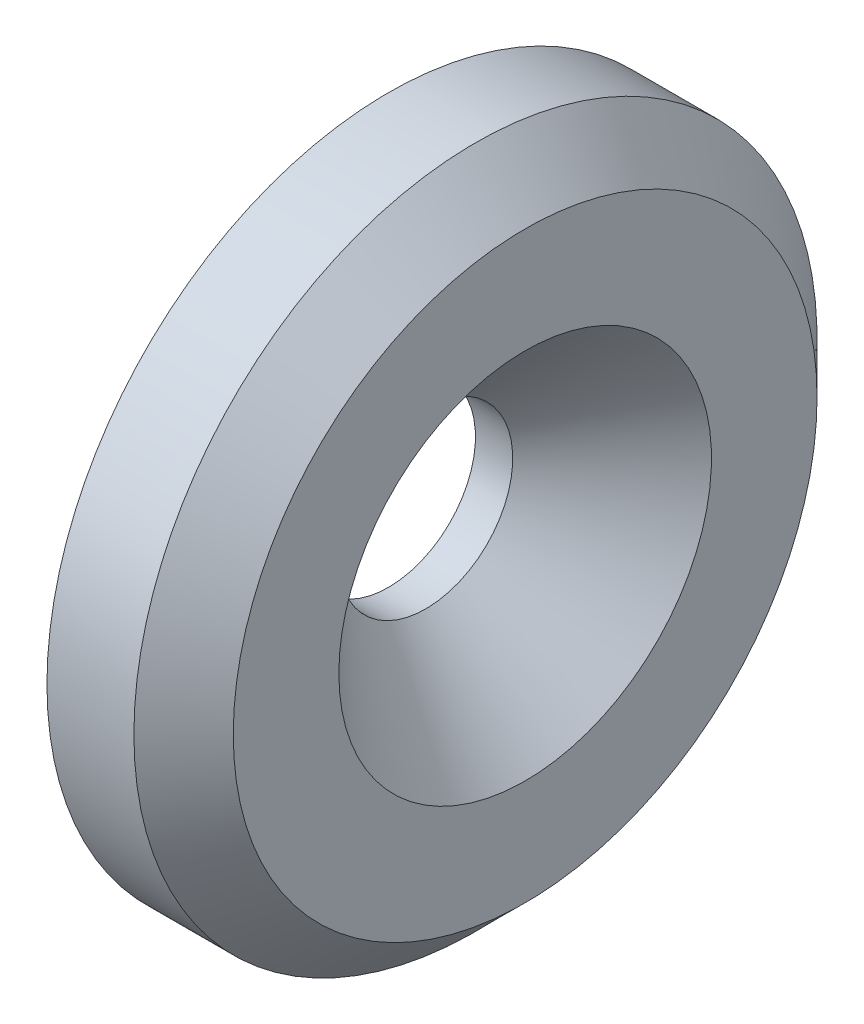
from build123d import *


with BuildPart() as part:
    # Skizze1 → Rotation1 (revolve)
    with BuildSketch(Plane.XY, mode=Mode.PRIVATE) as rotation1_sk:
        Polygon((-5.5, 3.5), (-5.5, 13.75), (-2, 13.75), (0, 11.75), (0, 7.5), (-4, 3.5), align=None)
    revolve(rotation1_sk.sketch.rotate(Axis((-50.114719061, 0, 0), (1, 0, 0)), 90), axis=Axis((-50.114719061, 0, 0), (1, 0, 0)))


solid = part.part
